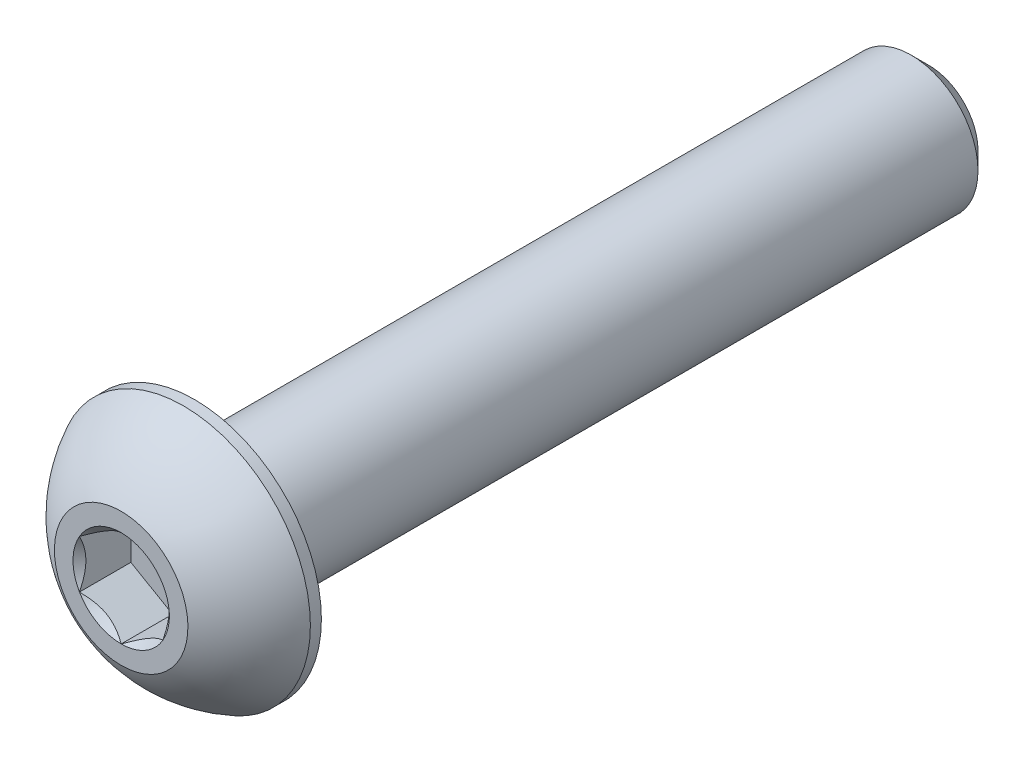
from build123d import *

# Parameters (mm, degrees)
CUT_EXTRUDE2_DEPTH = 1.54


with BuildPart() as part:
    # Sketch10 → Revolve3 (revolve)
    with BuildSketch(Plane(origin=(0, 0, 0), x_dir=(0, 0, -1), z_dir=(1, 0, 0))):
        Polygon((23.675, 2), (24.2, 1.475), (24.2, 0), (2.2, 0), (2.2, 2), align=None)
    revolve(axis=Axis((0, 0, 0), (0, 0, -1)))

    # Sketch7 → Revolve2 (revolve)
    with BuildSketch(Plane(origin=(0, 0, 0), x_dir=(0, 0, -1), z_dir=(1, 0, 0))):
        with BuildLine():
            Line((1.87, 3.8), (2.2, 3.8))
            Line((2.2, 3.8), (2.2, 0))
            Line((2.2, 0), (0, 0))
            Line((0, 0), (0, 2))
            ThreePointArc((0, 2), (0.793500147, 3.047002626), (1.87, 3.8))
        make_face()
    revolve(axis=Axis((0, 0, 0), (0, 0, -1)))

    # Sketch5 → Cut-Extrude2 (cut)
    with BuildSketch(Plane.XY):
        Polygon((1.25, -0.721687836), (1.25, 0.721687836), (0, 1.443375673), (-1.25, 0.721687836), (-1.25, -0.721687836), (0, -1.443375673), align=None)
    extrude(amount=-CUT_EXTRUDE2_DEPTH, mode=Mode.SUBTRACT)

    # Cut-Extrude3 cone 1 section (through the dimple's axis) → Cut-Extrude3 (revolve, cut)
    with BuildSketch(Plane(origin=(0, 0, 0), x_dir=(0, -1, 0), z_dir=(1, 0, 0))):
        Polygon((0, 0), (1.443375673, 0), (0, 1.443375673), align=None)
    revolve(axis=Axis((0, 0, 0), (0, 0, -1)), mode=Mode.SUBTRACT)


solid = part.part
